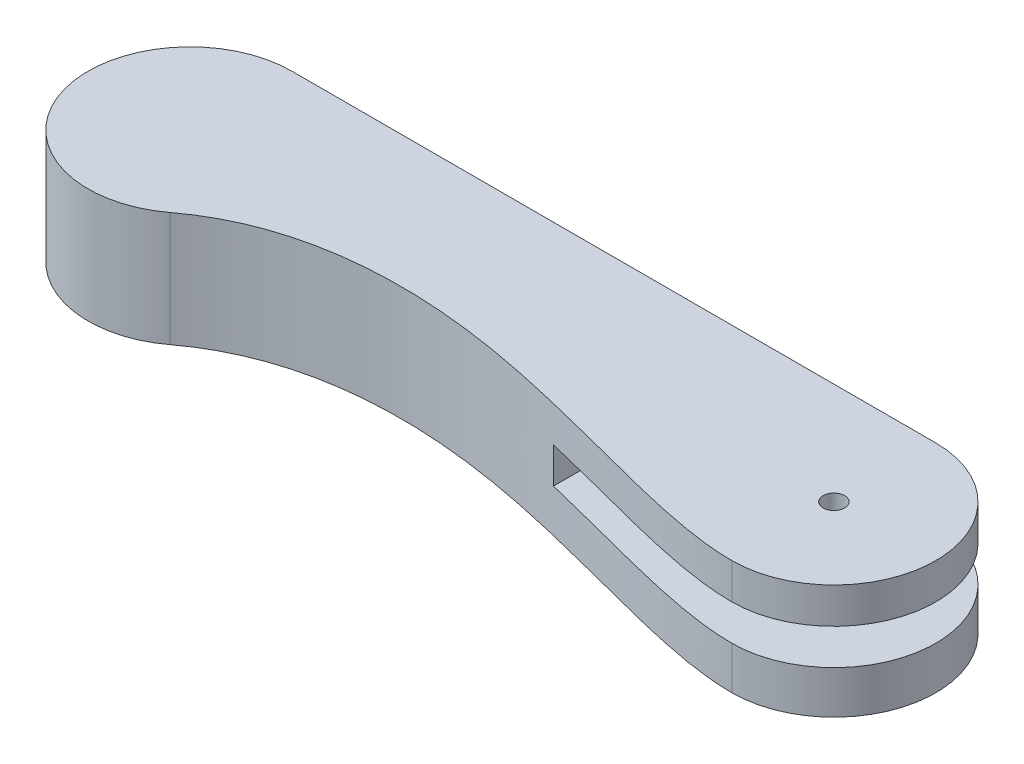
from build123d import *

# Parameters (mm, degrees)
BOSS_EXTRUDE1_DEPTH = 6
CUT_EXTRUDE1_REACH  = 63.234
SKETCH2_R           = 2.5
SKETCH3_R           = 1.5
CUT_EXTRUDE2_DEPTH  = 62.234181631
BOSS_EXTRUDE2_DEPTH = 5
BOSS_EXTRUDE3_DEPTH = 5
CUT_EXTRUDE3_REACH  = 65.005
SKETCH6_R           = 1.5
CUT_EXTRUDE4_REACH  = 65.005


with BuildPart() as part:
    # Sketch1 → Boss-Extrude1 (new body)
    with BuildSketch(Plane(origin=(0, 0, 0), x_dir=(1, 0, 0), z_dir=(0, 1, 0))):
        with BuildLine():
            Line((-45, 14.25), (45, 14.25))
            ThreePointArc((45, 14.25), (59.25, 0), (45, -14.25))
            Line((45, -14.25), (-45, -14.25))
            ThreePointArc((-45, -14.25), (-59.25, 0), (-45, 14.25))
        make_face()
    extrude(amount=BOSS_EXTRUDE1_DEPTH)

    # Sketch2 → Cut-Extrude1 (cut, up to next)
    with BuildSketch(Plane(origin=(0, 6, 0), x_dir=(1, 0, 0), z_dir=(0, 1, 0)), mode=Mode.PRIVATE) as cut_extrude1_sk1:
        with Locations(Location((-45, 8.25, 0), (0, 0, 270))):
            Circle(SKETCH2_R)
    cut_extrude1_tool1 = extrude(cut_extrude1_sk1.sketch, amount=-CUT_EXTRUDE1_REACH, mode=Mode.PRIVATE) & part.part
    # Sketch2 → Cut-Extrude1 (cut, up to next)
    with BuildSketch(Plane(origin=(0, 6, 0), x_dir=(1, 0, 0), z_dir=(0, 1, 0)), mode=Mode.PRIVATE) as cut_extrude1_sk2:
        with Locations(Location((-45, -8.25, 0), (0, 0, 270))):
            Circle(SKETCH2_R)
    cut_extrude1_tool2 = extrude(cut_extrude1_sk2.sketch, amount=-CUT_EXTRUDE1_REACH, mode=Mode.PRIVATE) & part.part
    add(cut_extrude1_tool1.solids().sort_by_distance((-45, 6, -8.25))[0], mode=Mode.SUBTRACT)
    add(cut_extrude1_tool2.solids().sort_by_distance((-45, 6, 8.25))[0], mode=Mode.SUBTRACT)

    # Sketch3 → Cut-Extrude2 (cut, through all)
    with BuildSketch(Plane.XZ):
        with Locations(Location((45, 0, 0), (0, 0, 270))):
            Circle(SKETCH3_R)
    extrude(amount=-CUT_EXTRUDE2_DEPTH, mode=Mode.SUBTRACT)

    # Sketch4 → Boss-Extrude2 (add)
    with BuildSketch(Plane(origin=(0, 6, 0), x_dir=(1, 0, 0), z_dir=(0, 1, 0))):
        with BuildLine():
            Line((-45, 14.25), (13.5, 14.25))
            Line((13.5, 14.25), (13.5, -14.25))
            Line((13.5, -14.25), (-45, -14.25))
            ThreePointArc((-45, -14.25), (-59.25, 0), (-45, 14.25))
        make_face()
    extrude(amount=BOSS_EXTRUDE2_DEPTH)

    # Sketch5 → Boss-Extrude3 (add)
    with BuildSketch(Plane(origin=(0, 11, 0), x_dir=(1, 0, 0), z_dir=(0, 1, 0))):
        with BuildLine():
            Line((-45, 14.25), (45, 14.25))
            ThreePointArc((45, 14.25), (59.25, 0), (45, -14.25))
            Line((45, -14.25), (-45, -14.25))
            ThreePointArc((-45, -14.25), (-59.25, 0), (-45, 14.25))
        make_face()
    extrude(amount=BOSS_EXTRUDE3_DEPTH)

    # Sketch6 → Cut-Extrude3 (cut, up to next)
    with BuildSketch(Plane(origin=(0, 16, 0), x_dir=(1, 0, 0), z_dir=(0, 1, 0)), mode=Mode.PRIVATE) as cut_extrude3_sk1:
        with Locations(Location((45, 0, 0), (0, 0, 90))):
            Circle(SKETCH6_R)
    cut_extrude3_tool1 = extrude(cut_extrude3_sk1.sketch, amount=-CUT_EXTRUDE3_REACH, mode=Mode.PRIVATE) & part.part
    add(cut_extrude3_tool1.solids().sort_by_distance((45, 16, 0))[0], mode=Mode.SUBTRACT)

    # Sketch7 → Cut-Extrude4 (cut, up to next)
    with BuildSketch(Plane(origin=(0, 16, 0), x_dir=(1, 0, 0), z_dir=(0, 1, 0)), mode=Mode.PRIVATE) as cut_extrude4_sk1:
        with BuildLine():
            ThreePointArc((-36.414021662, -11.372927327), (-40.472402094, -13.511600838), (-45, -14.25))
            Line((-45, -14.25), (45, -14.25))
            add(Edge.make_bspline(
                [(-36.414021662, -11.372927327), (-26.800353091, -4.115099353), (3.014951407, -1.887756349), (33.89735696, -14.25), (45, -14.25)],
                knots=[0, 0, 0, 0, 0.445881781, 1, 1, 1, 1], degree=3))
        make_face()
    cut_extrude4_tool1 = extrude(cut_extrude4_sk1.sketch, amount=-CUT_EXTRUDE4_REACH, mode=Mode.PRIVATE) & part.part
    add(cut_extrude4_tool1.solids().sort_by_distance((-5.252975, 16, 10.318122))[0], mode=Mode.SUBTRACT)


solid = part.part
